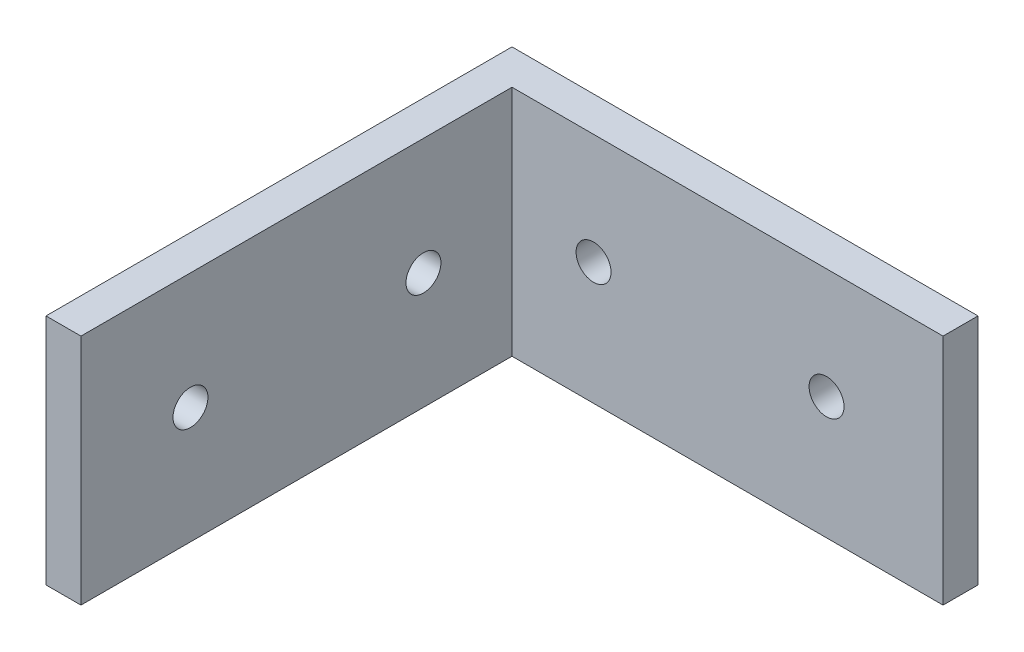
from build123d import *

# Parameters (mm, degrees)
ESQUISSE1_W             = 40
ESQUISSE1_H             = 20
BOSS_EXTRU_1_DEPTH      = 3
ESQUISSE2_R             = 1.5
ENL_V_MAT_EXTRU_1_DEPTH = 3
ESQUISSE3_W             = 3
ESQUISSE3_H             = 20
BOSS_EXTRU_2_DEPTH      = 37
ESQUISSE4_R             = 1.5
ENL_V_MAT_EXTRU_2_DEPTH = 3


with BuildPart() as part:
    # Esquisse1 → Boss.-Extru.1 (new body)
    with BuildSketch(Plane.XY):
        with Locations((20, 10)):
            Rectangle(ESQUISSE1_W, ESQUISSE1_H)
    extrude(amount=BOSS_EXTRU_1_DEPTH)

    # Esquisse2 → Enlèv. mat.-Extru.1 (cut)
    with BuildSketch(Plane.XY.offset(3)):
        with Locations((10, 10.5)):
            Circle(ESQUISSE2_R)
        with Locations((30, 10.5)):
            Circle(ESQUISSE2_R)
    extrude(amount=-ENL_V_MAT_EXTRU_1_DEPTH, mode=Mode.SUBTRACT)

    # Esquisse3 → Boss.-Extru.2 (add)
    with BuildSketch(Plane.XY.offset(3)):
        with Locations((1.5, 10)):
            Rectangle(ESQUISSE3_W, ESQUISSE3_H)
    extrude(amount=BOSS_EXTRU_2_DEPTH)

    # Esquisse4 → Enlèv. mat.-Extru.2 (cut)
    with BuildSketch(Plane.ZY):
        with Locations((10.6, 10)):
            Circle(ESQUISSE4_R)
        with Locations((30.6, 10)):
            Circle(ESQUISSE4_R)
    extrude(amount=-ENL_V_MAT_EXTRU_2_DEPTH, mode=Mode.SUBTRACT)


solid = part.part
